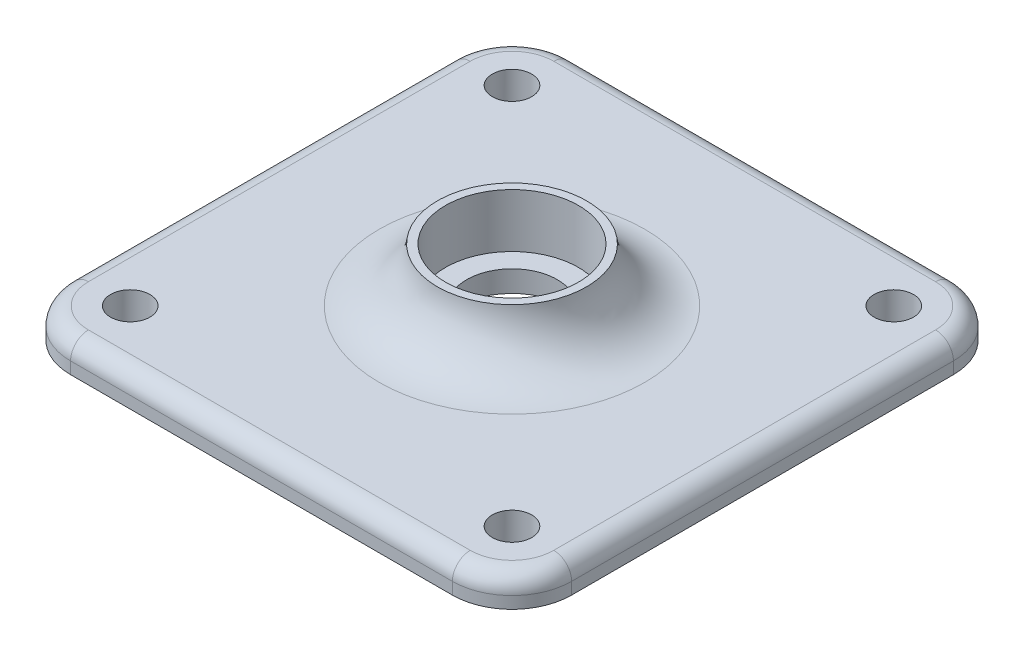
from build123d import *

# Parameters (mm, degrees)
BOSS_EXTRUDE1_DEPTH      = 5
FILLET1_R                = 3
M6_CLEARANCE_HOLE1_D     = 6.6
M6_CLEARANCE_HOLE1_DEPTH = 8
M6_CLEARANCE_HOLE1_TIP   = 1.982840043


with BuildPart() as part:
    # Sketch1 → Boss-Extrude1 (new body)
    with BuildSketch(Plane(origin=(0, 0, 0), x_dir=(1, 0, 0), z_dir=(0, 1, 0))):
        with BuildLine():
            Line((32, 42), (-32, 42))
            ThreePointArc((-32, 42), (-39.071067812, 39.071067812), (-42, 32))
            Line((-42, 32), (-42, -32))
            ThreePointArc((-42, -32), (-39.071067812, -39.071067812), (-32, -42))
            Line((-32, -42), (32, -42))
            ThreePointArc((32, -42), (39.071067812, -39.071067812), (42, -32))
            Line((42, -32), (42, 32))
            ThreePointArc((42, 32), (39.071067812, 39.071067812), (32, 42))
        make_face()
    extrude(amount=BOSS_EXTRUDE1_DEPTH)

    # Sketch3 → Revolve2 (revolve)
    with BuildSketch(Plane.XY):
        with BuildLine():
            Line((-22.25, 5), (-12.5, 5))
            Line((-12.5, 5), (-11.15, 5))
            Line((-11.15, 5), (-11.15, 14))
            Line((-11.15, 14), (-12.5, 14))
            ThreePointArc((-12.5, 14), (-15.66727432, 7.649963846), (-22.25, 5))
        make_face()
        with BuildLine():
            Line((-22.25, 5), (-12.5, 5))
            Line((-12.5, 5), (-11.15, 5))
            Line((-11.15, 5), (-11.15, 14))
            Line((-11.15, 14), (-12.5, 14))
            ThreePointArc((-12.5, 14), (-15.66727432, 7.649963846), (-22.25, 5))
        make_face()
    revolve(axis=Axis((0, 0, 0), (0, -1, 0)))

    # Sketch3<5> → Cut-Revolve2 (revolve, cut)
    with BuildSketch(Plane.XY):
        with BuildLine():
            Line((0, 0), (0, 5))
            Line((0, 5), (-7.6, 5))
            ThreePointArc((-7.6, 5), (-8.694616444, 4.701278719), (-9.6, 4.017392631))
            Line((-9.6, 4.017392631), (-9.6, 0))
            Line((-9.6, 0), (0, 0))
        make_face()
    revolve(axis=Axis((0, 0, 0), (0, -1, 0)), mode=Mode.SUBTRACT)

    # Fillet1
    fillet1_edges = [part.edges().sort_by_distance(p)[0] for p in [
        (42, 5, 0),
        (39.071067812, 5, -39.071067812),
        (0, 5, -42),
        (-39.071067812, 5, -39.071067812),
        (-42, 5, 0),
        (-39.071067812, 5, 39.071067812),
        (0, 5, 42),
        (39.071067812, 5, 39.071067812),
    ]]
    fillet(fillet1_edges, radius=FILLET1_R)

    # M6 Clearance Hole1
    with Locations(Plane(origin=(0, 5, 0), x_dir=(1, 0, 0), z_dir=(0, 1, 0))):
        with Locations((-32, 32), (-32, -32), (32, -32), (32, 32)):
            Hole(M6_CLEARANCE_HOLE1_D / 2, depth=M6_CLEARANCE_HOLE1_DEPTH)
            with Locations((0, 0, -(M6_CLEARANCE_HOLE1_DEPTH + M6_CLEARANCE_HOLE1_TIP / 2))):  # 118° drill point
                Cone(0, M6_CLEARANCE_HOLE1_D / 2, M6_CLEARANCE_HOLE1_TIP, mode=Mode.SUBTRACT)


solid = part.part
